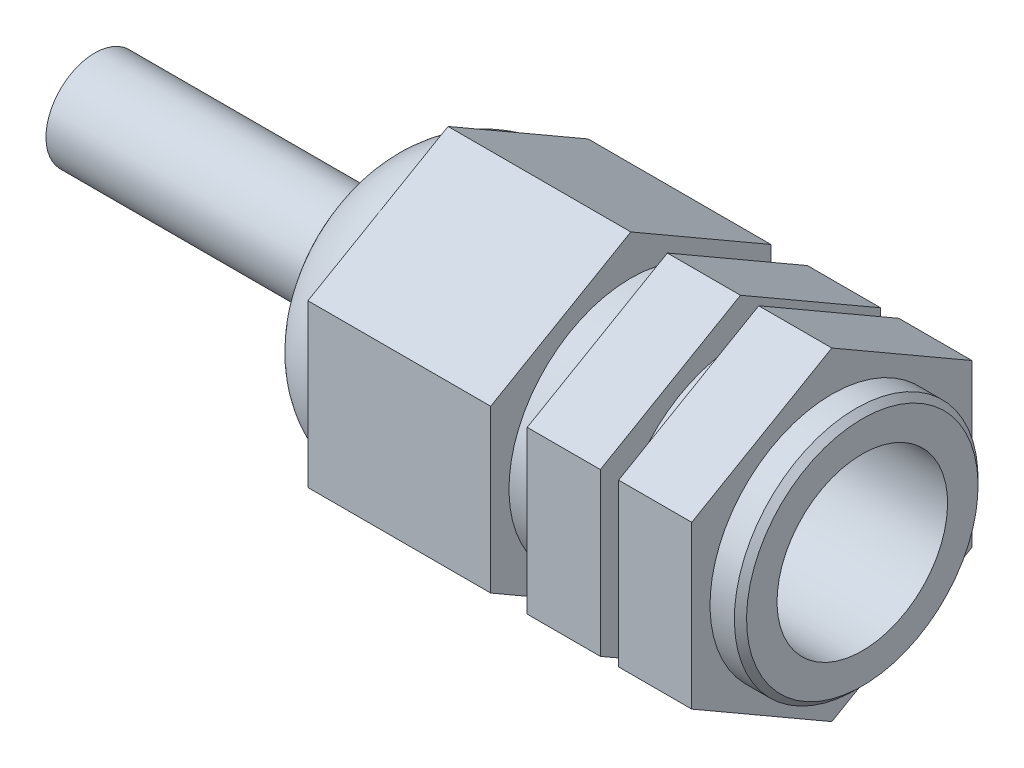
from build123d import *

# Parameters (mm, degrees)
CHAMFER1_SIZE       = 0.5
BOSS_EXTRUDE1_START = -6
SKETCH2_R           = 10
BOSS_EXTRUDE1_DEPTH = 6
BOSS_EXTRUDE2_START = -15
SKETCH3_R           = 10
BOSS_EXTRUDE2_DEPTH = 15
BOSS_EXTRUDE3_START = 1.5
SKETCH2_2_R         = 10
BOSS_EXTRUDE3_DEPTH = 6
SKETCH4_R           = 4
BOSS_EXTRUDE4_DEPTH = 28


with BuildPart() as part:
    # Sketch1 → Revolve1 (revolve)
    with BuildSketch(Plane.XY):
        with BuildLine():
            Line((5, 7), (40, 7))
            Line((40, 7), (40, 10))
            Line((40, 10), (30, 10))
            Line((30, 10), (30, 11.5))
            Line((30, 11.5), (24, 11.5))
            Line((24, 11.5), (24, 10))
            Line((24, 10), (21, 10))
            Line((21, 10), (21, 11.5))
            Line((21, 11.5), (7, 11.5))
            ThreePointArc((7, 11.5), (2.050252532, 9.449747468), (0, 4.5))
            Line((0, 4.5), (0, 3.5))
            Line((0, 3.5), (5, 3.5))
            Line((5, 3.5), (5, 7))
        make_face()
    revolve(axis=Axis((72.287259513, 0, 0), (-1, 0, 0)))

    # Chamfer1
    chamfer1_edges = [part.edges().sort_by_distance(p)[0] for p in [
        (40, -10, 0),
    ]]
    chamfer(chamfer1_edges, length=CHAMFER1_SIZE)

    # Sketch2 → Boss-Extrude1 (add)
    with BuildSketch(Plane(origin=(30, 0, 0), x_dir=(0, 0, -1), z_dir=(1, 0, 0)).offset(BOSS_EXTRUDE1_START)):
        Polygon((0, 13.279056191), (-11.5, 6.639528096), (-11.5, -6.639528096), (0, -13.279056191), (11.5, -6.639528096), (11.5, 6.639528096), align=None)
        Circle(SKETCH2_R, mode=Mode.SUBTRACT)
    extrude(amount=BOSS_EXTRUDE1_DEPTH)

    # Sketch3 → Boss-Extrude2 (add)
    with BuildSketch(Plane(origin=(21, 0, 0), x_dir=(0, 0, -1), z_dir=(1, 0, 0)).offset(BOSS_EXTRUDE2_START)):
        Polygon((0, 13.279056191), (-11.5, 6.639528096), (-11.5, -6.639528096), (0, -13.279056191), (11.5, -6.639528096), (11.5, 6.639528096), align=None)
        Circle(SKETCH3_R, mode=Mode.SUBTRACT)
    extrude(amount=BOSS_EXTRUDE2_DEPTH)


with BuildPart() as body_2:
    # Sketch2<2> → Boss-Extrude3 (new body)
    with BuildSketch(Plane(origin=(30, 0, 0), x_dir=(0, 0, -1), z_dir=(1, 0, 0)).offset(BOSS_EXTRUDE3_START)):
        Polygon((0, 13.279056191), (-11.5, 6.639528096), (-11.5, -6.639528096), (0, -13.279056191), (11.5, -6.639528096), (11.5, 6.639528096), align=None)
        Circle(SKETCH2_2_R, mode=Mode.SUBTRACT)
    extrude(amount=BOSS_EXTRUDE3_DEPTH)


with BuildPart() as body_3:
    # Sketch4 → Boss-Extrude4 (new body)
    with BuildSketch(Plane(origin=(5, 0, 0), x_dir=(0, 0, -1), z_dir=(1, 0, 0))):
        Circle(SKETCH4_R)
    extrude(amount=-BOSS_EXTRUDE4_DEPTH)


solid = Compound([part.part, body_2.part, body_3.part])
